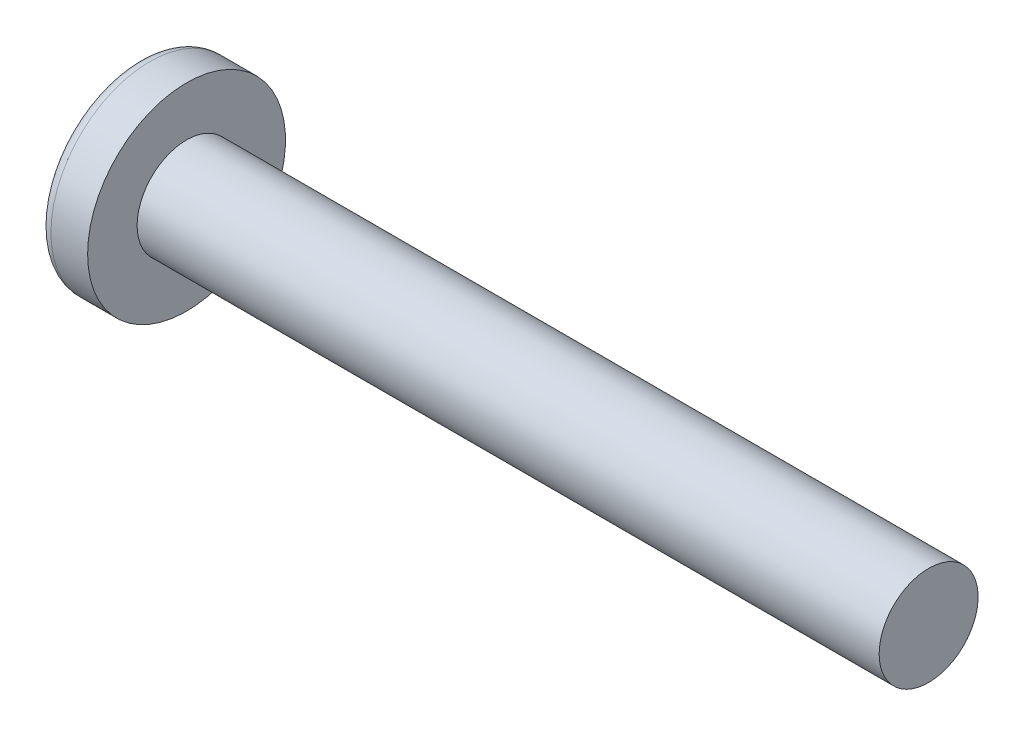
from build123d import *

# Parameters (mm, degrees)
CIRPATTERN1_COUNT = 2
CIRPATTERN1_ANGLE = 90


with BuildPart() as part:
    # BodySke → Base-Revolve (revolve)
    with BuildSketch(Plane.XY, mode=Mode.PRIVATE) as base_revolve_sk:
        with BuildLine():
            Line((3.1, 2), (3.1, 4))
            Line((3.1, 4), (1.616353821, 4))
            ThreePointArc((1.616353821, 4), (1.397629036, 3.947269784), (1.226960106, 3.800664452))
            ThreePointArc((1.226960106, 3.800664452), (0.314340807, 1.996902688), (0, 0))
            Line((0, 0), (33.1, 0))
            Line((33.1, 0), (33.1, 2))
            Line((33.1, 2), (3.1, 2))
        make_face()
    revolve(base_revolve_sk.sketch.rotate(Axis((-25.4, 0, 0), (1, 0, 0)), 90), axis=Axis((-25.4, 0, 0), (1, 0, 0)))

    # Sketch3 → Cut-Loft1 section 0
    with BuildSketch(Plane(origin=(0, 0, 0), x_dir=(0, 0, -1), z_dir=(1, 0, 0))):
        with BuildLine():
            Line((0.465, -2.2), (-0.465, -2.2))
            Line((-0.465, -2.2), (-0.465, 2.2))
            Line((-0.465, 2.2), (0.465, 2.2))
            Line((0.465, 2.2), (0.465, -2.2))
        make_face()
    # Sketch4 → Cut-Loft1 section 1
    with BuildSketch(Plane(origin=(2.45, 0, 0), x_dir=(0, 0, -1), z_dir=(1, 0, 0))):
        with BuildLine():
            Line((0.2325, -0.2325), (-0.2325, -0.2325))
            Line((-0.2325, -0.2325), (-0.2325, 0.2325))
            Line((-0.2325, 0.2325), (0.2325, 0.2325))
            Line((0.2325, 0.2325), (0.2325, -0.2325))
        make_face()
    cut_loft1 = loft(mode=Mode.SUBTRACT)

    # CirPattern1: Cut-Loft1 ×2 about axis
    cirpattern1_axis = Axis((0, 0, 0), (1, 0, 0))
    for i in range(1, CIRPATTERN1_COUNT):
        add(cut_loft1.rotate(cirpattern1_axis, i * CIRPATTERN1_ANGLE / (CIRPATTERN1_COUNT - 1)), mode=Mode.SUBTRACT)


solid = part.part
